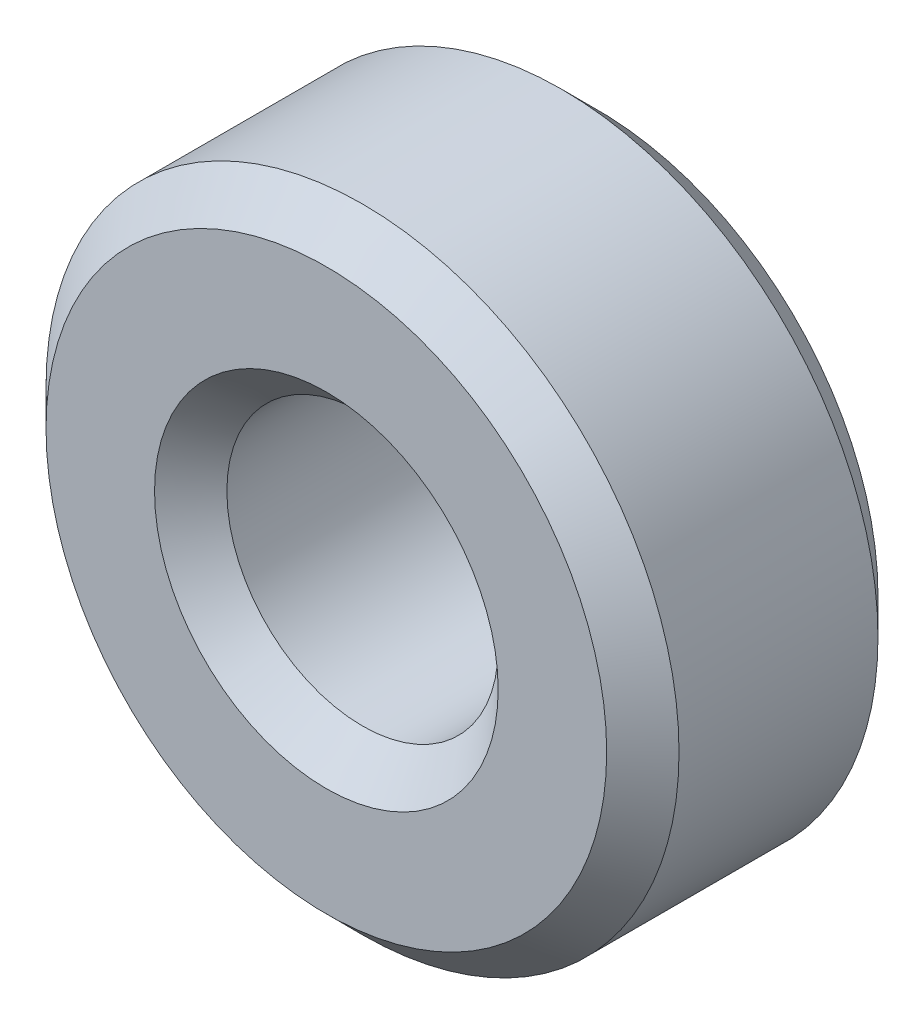
from build123d import *

# Parameters (mm, degrees)
SKETCH_1_R      = 3.5
SKETCH_1_R_2    = 1.5
EXTRUDE_1_DEPTH = 3
CHAMFER_1_SIZE  = 0.4


with BuildPart() as part:
    # 草图1 → 凸台-拉伸1 (new body)
    with BuildSketch(Plane.XY):
        Circle(SKETCH_1_R)
        Circle(SKETCH_1_R_2, mode=Mode.SUBTRACT)
    extrude(amount=EXTRUDE_1_DEPTH)

    # 倒角1
    chamfer_1_edges = [part.edges().sort_by_distance(p)[0] for p in [
        (-3.5, 0, 0),
        (-3.5, 0, 3),
        (-1.5, 0, 0),
        (-1.5, 0, 3),
    ]]
    chamfer(chamfer_1_edges, length=CHAMFER_1_SIZE)


solid = part.part
